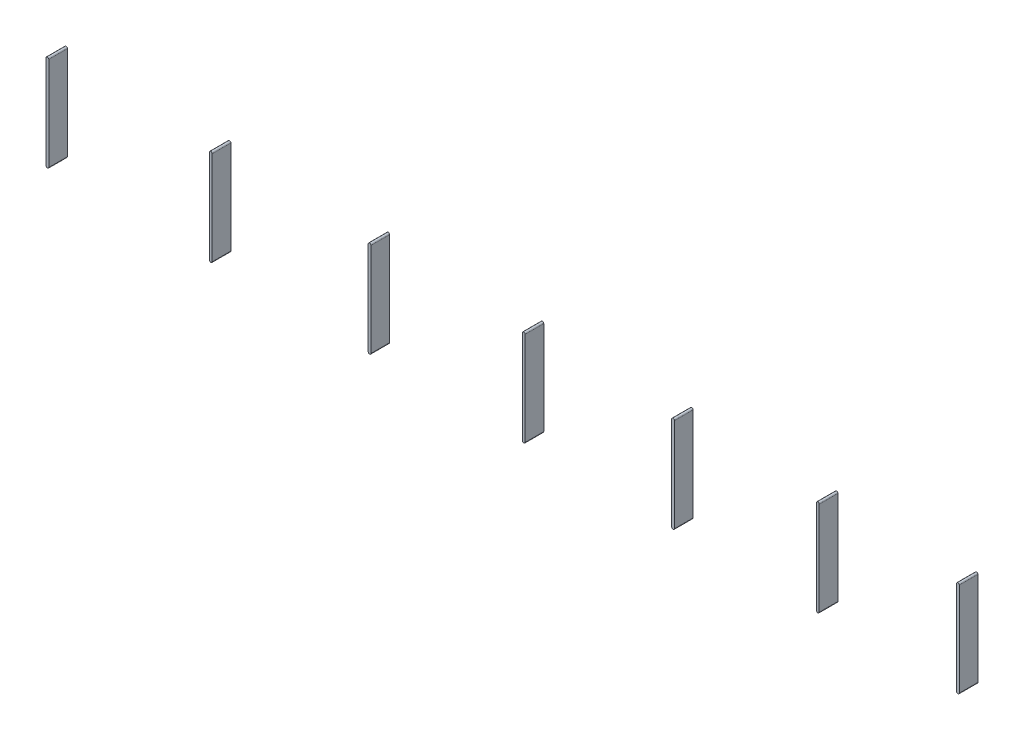
from build123d import *

# Parameters (mm, degrees)
BOSS_EXTRUDE1_DEPTH   = 4
BOSS_EXTRUDE1_2_DEPTH = 4
BOSS_EXTRUDE1_3_DEPTH = 4
BOSS_EXTRUDE1_4_DEPTH = 4
BOSS_EXTRUDE1_5_DEPTH = 4
BOSS_EXTRUDE1_6_DEPTH = 4
BOSS_EXTRUDE1_7_DEPTH = 4


with BuildPart() as part:
    # Sketch1 → Boss-Extrude1 (new body)
    with BuildSketch(Plane.XY):
        with BuildLine():
            Line((0.3, 0), (0.3, -20))
            ThreePointArc((0.3, -20), (0, -20.3), (-0.3, -20))
            Line((-0.3, -20), (-0.3, 0))
            ThreePointArc((-0.3, 0), (0, 0.3), (0.3, 0))
        make_face()
    extrude(amount=BOSS_EXTRUDE1_DEPTH)


with BuildPart() as body_2:
    # Sketch1 → Boss-Extrude1 2 (new body)
    with BuildSketch(Plane.XY):
        with BuildLine():
            Line((61.3, 0), (61.3, -20))
            ThreePointArc((61.3, -20), (61, -20.3), (60.7, -20))
            Line((60.7, -20), (60.7, 0))
            ThreePointArc((60.7, 0), (61, 0.3), (61.3, 0))
        make_face()
    extrude(amount=BOSS_EXTRUDE1_2_DEPTH)


with BuildPart() as body_3:
    # Sketch1 → Boss-Extrude1 3 (new body)
    with BuildSketch(Plane.XY):
        with BuildLine():
            Line((31.3, 0), (31.3, -20))
            ThreePointArc((31.3, -20), (31, -20.3), (30.7, -20))
            Line((30.7, -20), (30.7, 0))
            ThreePointArc((30.7, 0), (31, 0.3), (31.3, 0))
        make_face()
    extrude(amount=BOSS_EXTRUDE1_3_DEPTH)


with BuildPart() as body_4:
    # Sketch1 → Boss-Extrude1 4 (new body)
    with BuildSketch(Plane.XY):
        with BuildLine():
            Line((-31.7, 0), (-31.7, -20))
            ThreePointArc((-31.7, -20), (-32, -20.3), (-32.3, -20))
            Line((-32.3, -20), (-32.3, 0))
            ThreePointArc((-32.3, 0), (-32, 0.3), (-31.7, 0))
        make_face()
    extrude(amount=BOSS_EXTRUDE1_4_DEPTH)


with BuildPart() as body_5:
    # Sketch1 → Boss-Extrude1 5 (new body)
    with BuildSketch(Plane.XY):
        with BuildLine():
            Line((-64.7, 0), (-64.7, -20))
            ThreePointArc((-64.7, -20), (-65, -20.3), (-65.3, -20))
            Line((-65.3, -20), (-65.3, 0))
            ThreePointArc((-65.3, 0), (-65, 0.3), (-64.7, 0))
        make_face()
    extrude(amount=BOSS_EXTRUDE1_5_DEPTH)


with BuildPart() as body_6:
    # Sketch1 → Boss-Extrude1 6 (new body)
    with BuildSketch(Plane.XY):
        with BuildLine():
            Line((-98.7, 0), (-98.7, -20))
            ThreePointArc((-98.7, -20), (-99, -20.3), (-99.3, -20))
            Line((-99.3, -20), (-99.3, 0))
            ThreePointArc((-99.3, 0), (-99, 0.3), (-98.7, 0))
        make_face()
    extrude(amount=BOSS_EXTRUDE1_6_DEPTH)


with BuildPart() as body_7:
    # Sketch1 → Boss-Extrude1 7 (new body)
    with BuildSketch(Plane.XY):
        with BuildLine():
            Line((-133.7, 0), (-133.7, -20))
            ThreePointArc((-133.7, -20), (-134, -20.3), (-134.3, -20))
            Line((-134.3, -20), (-134.3, 0))
            ThreePointArc((-134.3, 0), (-134, 0.3), (-133.7, 0))
        make_face()
    extrude(amount=BOSS_EXTRUDE1_7_DEPTH)


solid = Compound([part.part, body_2.part, body_3.part, body_4.part, body_5.part, body_6.part, body_7.part])
